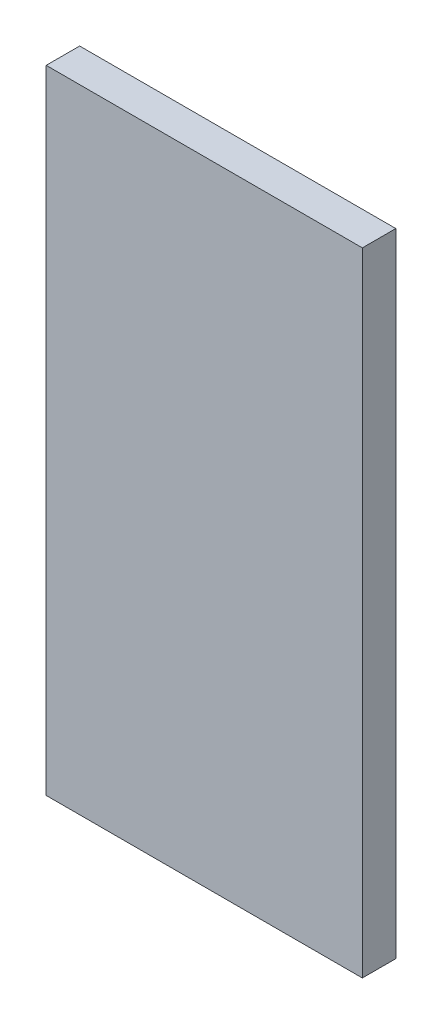
from build123d import *

# Parameters (mm, degrees)
SKETCH1_W           = 15
SKETCH1_H           = 30
BOSS_EXTRUDE1_DEPTH = 0.79375


with BuildPart() as part:
    # Sketch1 → Boss-Extrude1 (new, symmetric)
    with BuildSketch(Plane.XY):
        Rectangle(SKETCH1_W, SKETCH1_H)
    extrude(amount=BOSS_EXTRUDE1_DEPTH, both=True)


solid = part.part
